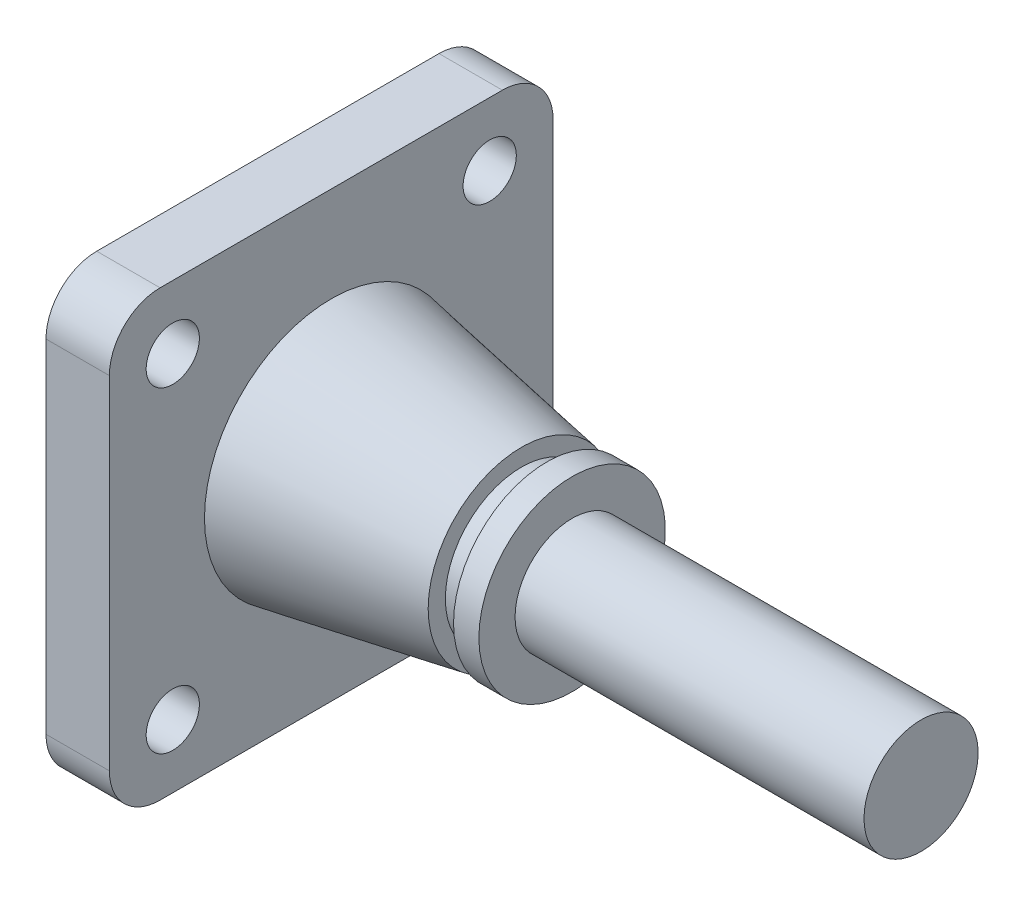
from build123d import *

# Parameters (mm, degrees)
SKETCH4_OUTSIDE_W       = 94.32
SKETCH4_OUTSIDE_H       = 94.32
SKETCH4_OUTSIDE_W_2     = 35
SKETCH4_OUTSIDE_H_2     = 35
CUT_EXTRUDE1_DEPTH      = 5
FILLET1_R               = 4
CUT_EXTRUDE2_DEPTH      = 53.697949186
CUT_EXTRUDE2_DEPTH_BACK = 53.697949186
SKETCH5_R               = 2.1


with BuildPart() as part:
    # Sketch3 → Revolve1 (revolve)
    with BuildSketch(Plane(origin=(0, 0, 0), x_dir=(1, 0, 0), z_dir=(0, 1, 0))):
        Polygon((0, 0), (0, 35), (5, 35), (5, 10), (20, 7.355095289), (20, 6), (22, 6), (22, 7.355095289), (24, 7.355095289), (24, 4.5), (51.524980907, 4.5), (51.524980907, 0), align=None)
    revolve(axis=Axis((0, 0, 0), (1, 0, 0)))

    # Sketch4 outside → Cut-Extrude1 (cut)
    with BuildSketch(Plane(origin=(5, 0, 0), x_dir=(0, 0, -1), z_dir=(1, 0, 0))):
        Rectangle(SKETCH4_OUTSIDE_W, SKETCH4_OUTSIDE_H)
        Rectangle(SKETCH4_OUTSIDE_W_2, SKETCH4_OUTSIDE_H_2, mode=Mode.SUBTRACT)
    extrude(amount=-CUT_EXTRUDE1_DEPTH, mode=Mode.SUBTRACT)

    # Fillet1
    fillet1_edges = [part.edges().sort_by_distance(p)[0] for p in [
        (2.5, 17.5, -17.5),
        (2.5, -17.5, -17.5),
        (2.5, -17.5, 17.5),
        (2.5, 17.5, 17.5),
    ]]
    fillet(fillet1_edges, radius=FILLET1_R)

    # Sketch5 → Cut-Extrude2 (cut, two sides: drawn at the far end of the back side and taken through both)
    with BuildSketch(Plane(origin=(5, 0, 0), x_dir=(0, 0, -1), z_dir=(1, 0, 0)).offset(-CUT_EXTRUDE2_DEPTH_BACK)):
        with Locations((-12.5, 12.5)):
            Circle(SKETCH5_R)
        with Locations((12.5, 12.5)):
            Circle(SKETCH5_R)
        with Locations((12.5, -12.5)):
            Circle(SKETCH5_R)
        with Locations((-12.5, -12.5)):
            Circle(SKETCH5_R)
    extrude(amount=CUT_EXTRUDE2_DEPTH + CUT_EXTRUDE2_DEPTH_BACK, mode=Mode.SUBTRACT)


solid = part.part
